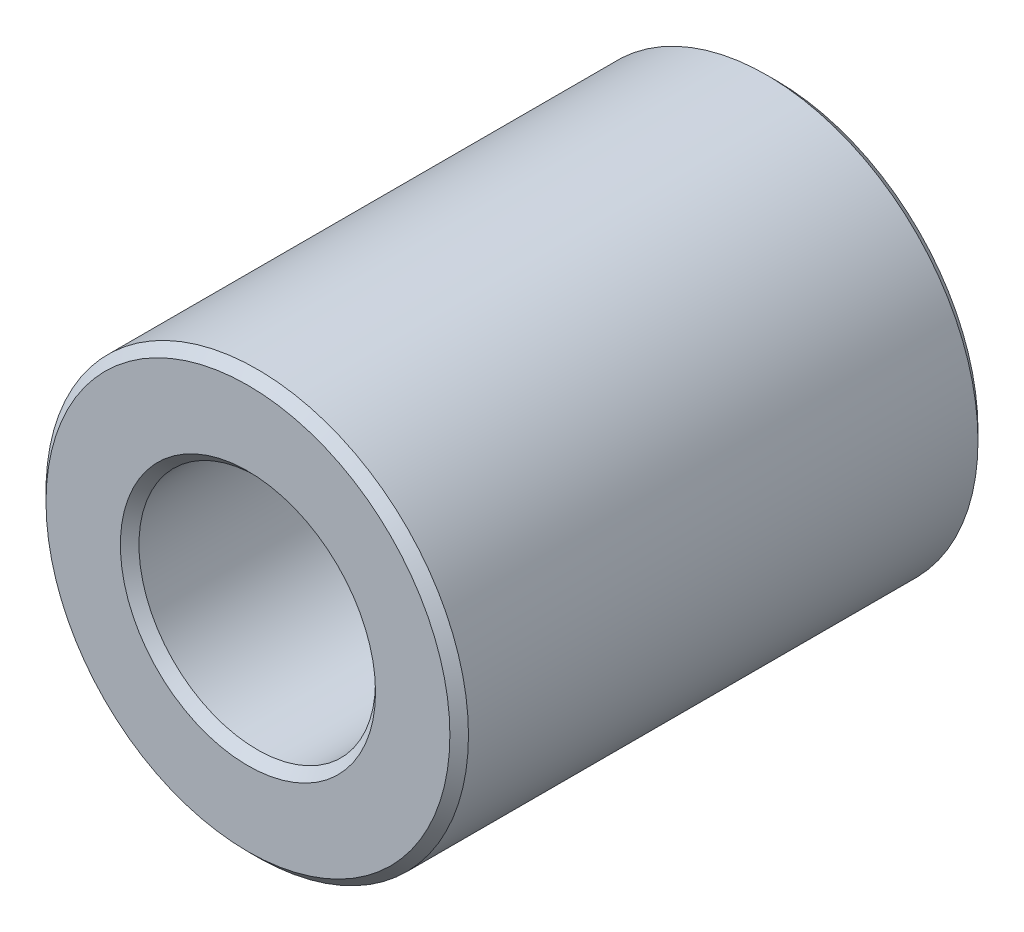
from build123d import *

# Parameters (mm, degrees)
BOSS_EXTRUDE1_DEPTH      = 3.96875
BOSS_EXTRUDE1_DEPTH_BACK = 3.96875
SKETCH3_R                = 3.175
SKETCH3_R_2              = 1.778
CHAMFER1_SIZE            = 0.1397


with BuildPart() as part:
    # Sketch3 → Boss-Extrude1 (new, two sides: drawn at the far end of the back side and taken through both)
    with BuildSketch(Plane.XY.offset(-BOSS_EXTRUDE1_DEPTH_BACK)):
        Circle(SKETCH3_R)
        Circle(SKETCH3_R_2, mode=Mode.SUBTRACT)
    extrude(amount=BOSS_EXTRUDE1_DEPTH + BOSS_EXTRUDE1_DEPTH_BACK)

    # Chamfer1
    chamfer1_edges = [part.edges().sort_by_distance(p)[0] for p in [
        (-3.175, 0, -3.96875),
        (-1.778, 0, -3.96875),
        (-3.175, 0, 3.96875),
        (-1.778, 0, 3.96875),
    ]]
    chamfer(chamfer1_edges, length=CHAMFER1_SIZE)


solid = part.part
